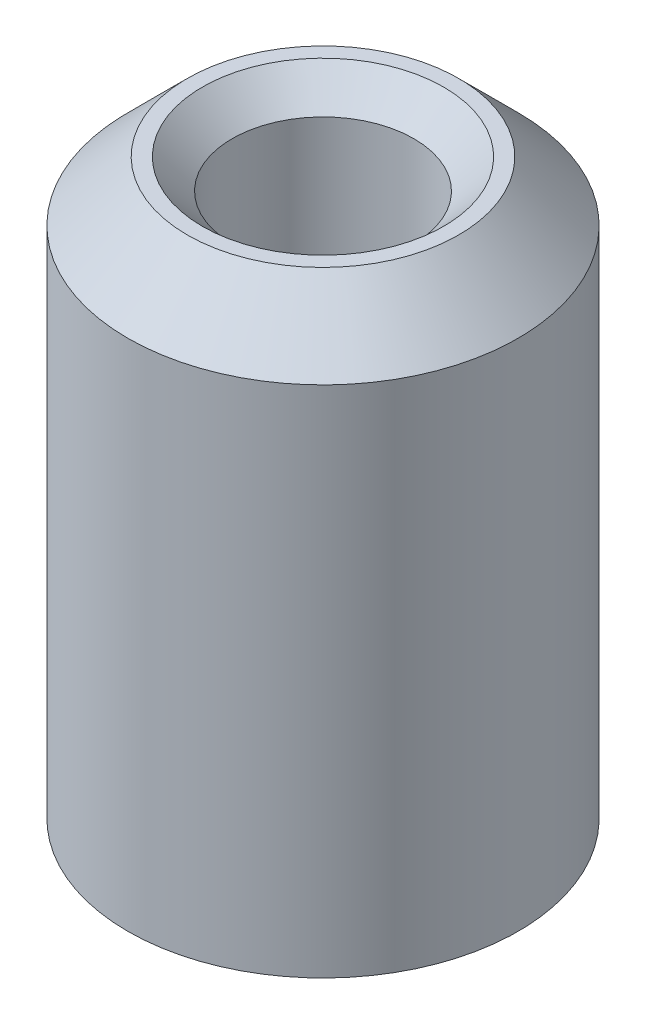
from build123d import *

# Parameters (mm, degrees)
SKETCH1_R           = 6.5532
SKETCH1_R_2         = 3.05
BOSS_EXTRUDE1_DEPTH = 19.24
CHAMFER1_SIZE       = 2
CHAMFER2_SIZE       = 1


with BuildPart() as part:
    # Sketch1 → Boss-Extrude1 (new body)
    with BuildSketch(Plane(origin=(0, 0, 0), x_dir=(1, 0, 0), z_dir=(0, 1, 0))):
        with Locations(Location((0, 0, 0), (0, 0, 270))):
            Circle(SKETCH1_R)
        with Locations(Location((0, 0, 0), (0, 0, 270))):
            Circle(SKETCH1_R_2, mode=Mode.SUBTRACT)
    extrude(amount=BOSS_EXTRUDE1_DEPTH)

    # Chamfer1
    chamfer1_edges = [part.edges().sort_by_distance(p)[0] for p in [
        (0, 19.24, -6.5532),
    ]]
    chamfer(chamfer1_edges, length=CHAMFER1_SIZE)

    # Chamfer2
    chamfer2_edges = [part.edges().sort_by_distance(p)[0] for p in [
        (0, 19.24, -3.05),
    ]]
    chamfer(chamfer2_edges, length=CHAMFER2_SIZE)


solid = part.part
